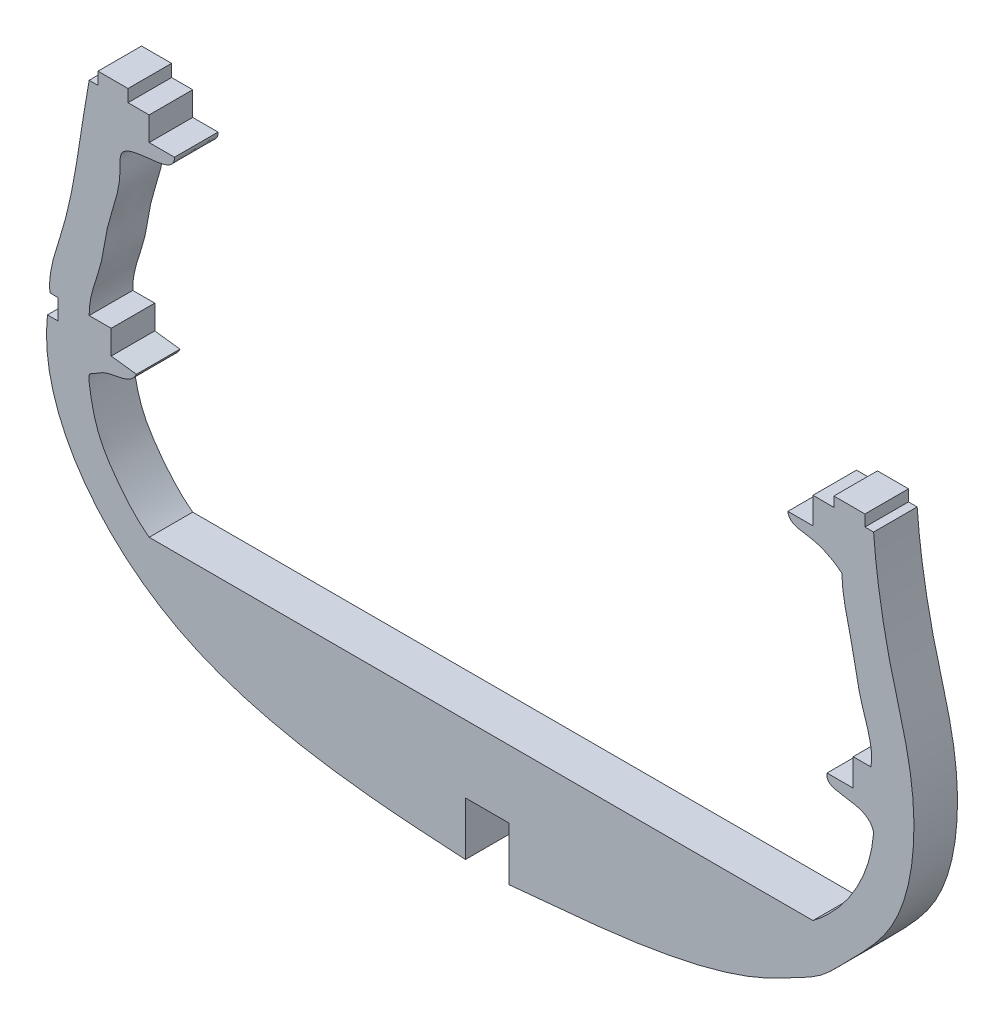
from build123d import *

# Parameters (mm, degrees)
EXTRUDE_1_DEPTH = 8


with BuildPart() as part:
    # 草图1 → 凸台-拉伸1 (new body)
    with BuildSketch(Plane.XY):
        with BuildLine():
            Line((0, 0), (121.892861676, 0))
            add(Edge.make_bspline(
                [(121.892861676, 0), (128.011971759, 4.601847517), (132.454502989, 11.788264632), (133.029184064, 19.505419747)],
                knots=[0, 0, 0, 0, 1, 1, 1, 1], degree=3))
            add(Edge.make_bspline(
                [(133.029184064, 19.505419747), (132.457883714, 22.04064129), (128.499225032, 22.345623299), (124.207815264, 23.217726577), (124.477695415, 24.757235523)],
                knots=[0, 0, 0, 0, 0.647423509, 1, 1, 1, 1], degree=3))
            Line((124.477695415, 24.757235523), (129.282930216, 24.757235523))
            Line((129.282930216, 24.757235523), (129.282930216, 29.75529488))
            Line((129.282930216, 29.75529488), (132.52615532, 29.75529488))
            add(Edge.make_bspline(
                [(132.52615532, 29.75529488), (133.109490058, 33.210504162), (130.53602349, 38.484222169), (129.182889891, 47.977798132), (127.274263485, 53.926700452), (127.192551314, 57.918432039)],
                knots=[0, 0, 0, 0, 0.352752785, 0.588696291, 1, 1, 1, 1], degree=3))
            add(Edge.make_bspline(
                [(117.280649471, 62.770146705), (117.475578993, 61.067706228), (122.209472834, 60.844278135), (125.144669848, 59.506949815), (127.192551314, 57.918432039)],
                knots=[0, 0, 0, 0, 0.387326309, 1, 1, 1, 1], degree=3))
            Line((117.280649471, 62.770146705), (121.892861676, 62.770146705))
            Line((121.892861676, 62.770146705), (121.892861676, 67.630194554))
            Line((121.892861676, 67.630194554), (125.7329066, 67.630194554))
            Line((125.7329066, 67.630194554), (125.7329066, 69.430400533))
            Line((125.7329066, 69.430400533), (131.438583204, 69.430400533))
            Line((131.438583204, 69.430400533), (131.438583204, 67.349539011))
            Line((131.438583204, 67.349539011), (133.029184064, 67.349539011))
            add(Edge.make_bspline(
                [(133.029184064, 67.349539011), (133.564901877, 60.247640999), (135.398192236, 49.245837259), (140.067666181, 33.723017907), (141.072006263, 19.819633097), (137.281476009, 5.343447435), (129.144560539, -2.25807561), (123.308303206, -8.431939681), (118.303600061, -10.858215118), (111.587418972, -14.456377453), (94.638037984, -20.019085561), (78.348366705, -21.008095209), (66.081887238, -22.204999352)],
                knots=[0, 0, 0, 0, 0.151237516, 0.236030191, 0.343538784, 0.444639981, 0.540293436, 0.575127263, 0.624226885, 0.656634372, 0.737279491, 1, 1, 1, 1], degree=3))
            Line((66.081887238, -22.204999352), (66.081887238, -12.404999352))
            Line((66.081887238, -12.404999352), (58.081887238, -12.404999352))
            Line((58.081887238, -12.404999352), (58.081887238, -22.204999352))
            add(Edge.make_bspline(
                [(58.081887238, -22.204999352), (46.068539701, -21.533775573), (26.7497211, -20.30053767), (-5.278411143, -9.189041191), (-20.324962842, 11.117665055), (-18.676297456, 26.036873145)],
                knots=[0, 0, 0, 0, 0.358876997, 0.569204983, 1, 1, 1, 1], degree=3))
            Line((-18.676297456, 26.036873145), (-16.752549329, 26.036873145))
            Line((-16.752549329, 26.036873145), (-16.752549329, 29.75529488))
            Line((-16.752549329, 29.75529488), (-18.223761048, 29.75529488))
            add(Edge.make_bspline(
                [(-18.223761048, 29.75529488), (-18.550546612, 33.449005635), (-13.7568902, 45.343133946), (-12.698829405, 58.21833283), (-11.014823623, 67.172575691)],
                knots=[0, 0, 0, 0, 0.279320488, 1, 1, 1, 1], degree=3))
            Line((-11.014823623, 67.172575691), (-9.396490731, 67.172575691))
            Line((-9.396490731, 67.172575691), (-9.396490731, 69.430400533))
            Line((-9.396490731, 69.430400533), (-3.879446783, 69.430400533))
            Line((-3.879446783, 69.430400533), (-3.879446783, 67.172575691))
            Line((-3.879446783, 67.172575691), (0, 67.172575691))
            Line((0, 67.172575691), (0, 62.770146705))
            Line((0, 62.770146705), (4.653581191, 62.770146705))
            add(Edge.make_bspline(
                [(-11.014823623, 29.75529488), (-11.09421657, 33.214563813), (-8.761277836, 37.759074692), (-8.084448244, 43.958305118), (-6.637070836, 49.261588362), (-5.048833168, 53.684470609), (-5.855262578, 61.815388525), (4.751990819, 59.02668145), (4.653581191, 62.770146705)],
                knots=[0, 0, 0, 0, 0.254341408, 0.369747983, 0.46600371, 0.663215063, 0.735184517, 1, 1, 1, 1], degree=3))
            Line((-11.014823623, 29.75529488), (-6.968991394, 29.75529488))
            Line((-6.968991394, 29.75529488), (-6.968991394, 25.338593411))
            Line((-6.968991394, 25.338593411), (-2.334674477, 24.757235523))
            add(Edge.make_bspline(
                [(-8.936877173, 21.67310046), (-6.944961427, 23.034723325), (-3.548495224, 22.119347239), (-2.334674477, 24.757235523)],
                knots=[0, 0, 0, 0, 1, 1, 1, 1], degree=3))
            add(Edge.make_bspline(
                [(0, 0), (-2.706760816, 1.985528057), (-7.907697304, 8.455845135), (-10.137815695, 13.053738583), (-11.328269229, 20.904647303), (-10.329171157, 20.762958158), (-8.936877173, 21.67310046)],
                knots=[0, 0, 0, 0, 0.369244443, 0.820134238, 0.903851561, 1, 1, 1, 1], degree=3))
        make_face()
    extrude(amount=EXTRUDE_1_DEPTH)


solid = part.part
